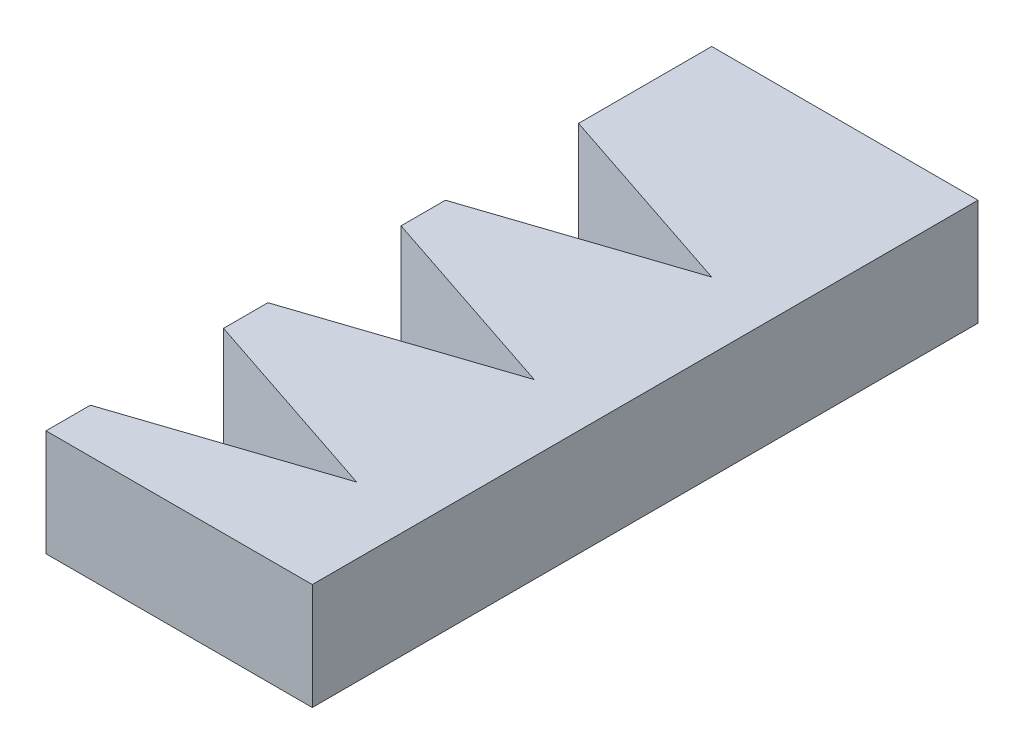
from build123d import *

# Parameters (mm, degrees)
SKETCH1_W           = 30
SKETCH1_H           = 75
BOSS_EXTRUDE1_DEPTH = 12
CUT_EXTRUDE1_DEPTH  = 12
LPATTERN1_COUNT     = 3
LPATTERN1_PITCH     = 20


with BuildPart() as part:
    # Sketch1 → Boss-Extrude1 (new body)
    with BuildSketch(Plane(origin=(0, 0, 0), x_dir=(1, 0, 0), z_dir=(0, 1, 0))):
        with Locations((15, 37.5)):
            Rectangle(SKETCH1_W, SKETCH1_H)
    extrude(amount=BOSS_EXTRUDE1_DEPTH)

    # Sketch3 → Cut-Extrude1 (cut)
    with BuildSketch(Plane(origin=(0, 0, 0), x_dir=(1, 0, 0), z_dir=(0, 1, 0))):
        Polygon((0, 5), (22.5, 12.5), (0, 20), align=None)
    cut_extrude1 = extrude(amount=CUT_EXTRUDE1_DEPTH, mode=Mode.SUBTRACT)

    # LPattern1: Cut-Extrude1 ×3
    with Locations(*[(0, 0, -i * LPATTERN1_PITCH) for i in range(1, LPATTERN1_COUNT)]):
        add(cut_extrude1, mode=Mode.SUBTRACT)


solid = part.part
